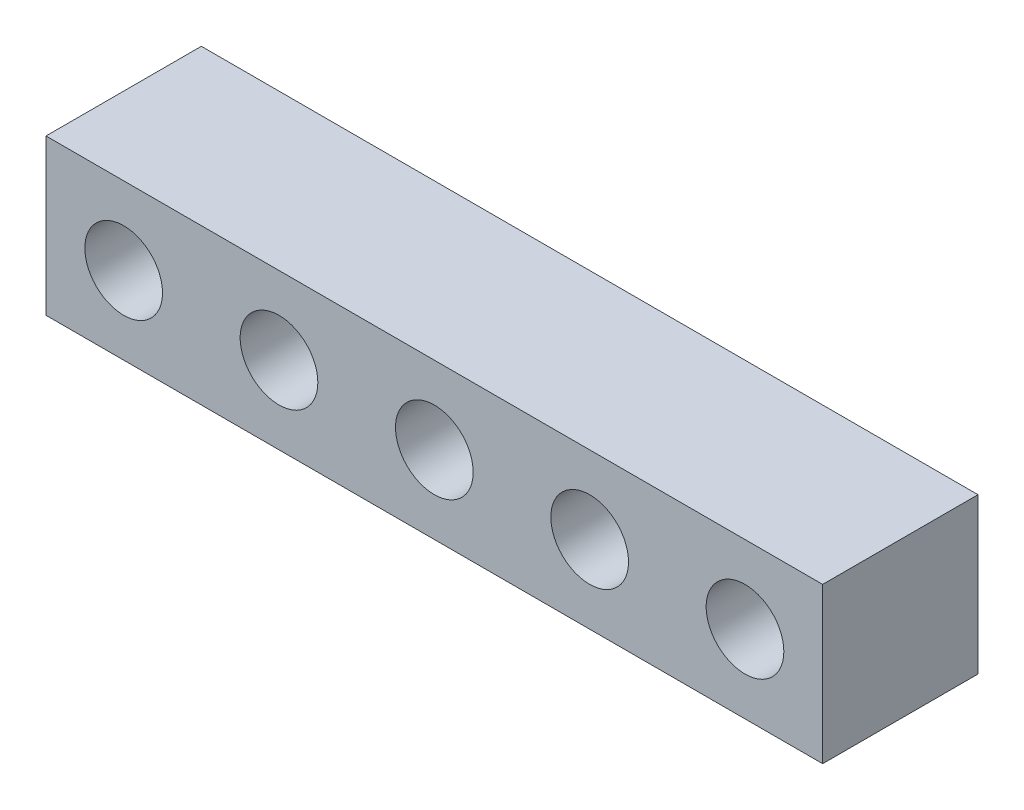
from build123d import *

# Parameters (mm, degrees)
ESQUISSE1_W             = 50
ESQUISSE1_H             = 10
BOSS_EXTRU_1_DEPTH      = 10
ENL_V_MAT_EXTRU_1_REACH = 53.962
ESQUISSE2_R             = 2.5


with BuildPart() as part:
    # Esquisse1 → Boss.-Extru.1 (new body)
    with BuildSketch(Plane.XY):
        with Locations((25, 5)):
            Rectangle(ESQUISSE1_W, ESQUISSE1_H)
    extrude(amount=BOSS_EXTRU_1_DEPTH)

    # Esquisse2 → Enlèv. mat.-Extru.1 (cut, up to next)
    with BuildSketch(Plane.XY.offset(10), mode=Mode.PRIVATE) as enl_v_mat_extru_1_sk1:
        with Locations((5, 5)):
            Circle(ESQUISSE2_R)
    enl_v_mat_extru_1_tool1 = extrude(enl_v_mat_extru_1_sk1.sketch, amount=-ENL_V_MAT_EXTRU_1_REACH, mode=Mode.PRIVATE) & part.part
    # Esquisse2 → Enlèv. mat.-Extru.1 (cut, up to next)
    with BuildSketch(Plane.XY.offset(10), mode=Mode.PRIVATE) as enl_v_mat_extru_1_sk2:
        with Locations((15, 5)):
            Circle(ESQUISSE2_R)
    enl_v_mat_extru_1_tool2 = extrude(enl_v_mat_extru_1_sk2.sketch, amount=-ENL_V_MAT_EXTRU_1_REACH, mode=Mode.PRIVATE) & part.part
    # Esquisse2 → Enlèv. mat.-Extru.1 (cut, up to next)
    with BuildSketch(Plane.XY.offset(10), mode=Mode.PRIVATE) as enl_v_mat_extru_1_sk3:
        with Locations((25, 5)):
            Circle(ESQUISSE2_R)
    enl_v_mat_extru_1_tool3 = extrude(enl_v_mat_extru_1_sk3.sketch, amount=-ENL_V_MAT_EXTRU_1_REACH, mode=Mode.PRIVATE) & part.part
    # Esquisse2 → Enlèv. mat.-Extru.1 (cut, up to next)
    with BuildSketch(Plane.XY.offset(10), mode=Mode.PRIVATE) as enl_v_mat_extru_1_sk4:
        with Locations((35, 5)):
            Circle(ESQUISSE2_R)
    enl_v_mat_extru_1_tool4 = extrude(enl_v_mat_extru_1_sk4.sketch, amount=-ENL_V_MAT_EXTRU_1_REACH, mode=Mode.PRIVATE) & part.part
    # Esquisse2 → Enlèv. mat.-Extru.1 (cut, up to next)
    with BuildSketch(Plane.XY.offset(10), mode=Mode.PRIVATE) as enl_v_mat_extru_1_sk5:
        with Locations((45, 5)):
            Circle(ESQUISSE2_R)
    enl_v_mat_extru_1_tool5 = extrude(enl_v_mat_extru_1_sk5.sketch, amount=-ENL_V_MAT_EXTRU_1_REACH, mode=Mode.PRIVATE) & part.part
    add(enl_v_mat_extru_1_tool1.solids().sort_by_distance((5, 5, 10))[0], mode=Mode.SUBTRACT)
    add(enl_v_mat_extru_1_tool2.solids().sort_by_distance((15, 5, 10))[0], mode=Mode.SUBTRACT)
    add(enl_v_mat_extru_1_tool3.solids().sort_by_distance((25, 5, 10))[0], mode=Mode.SUBTRACT)
    add(enl_v_mat_extru_1_tool4.solids().sort_by_distance((35, 5, 10))[0], mode=Mode.SUBTRACT)
    add(enl_v_mat_extru_1_tool5.solids().sort_by_distance((45, 5, 10))[0], mode=Mode.SUBTRACT)


solid = part.part
